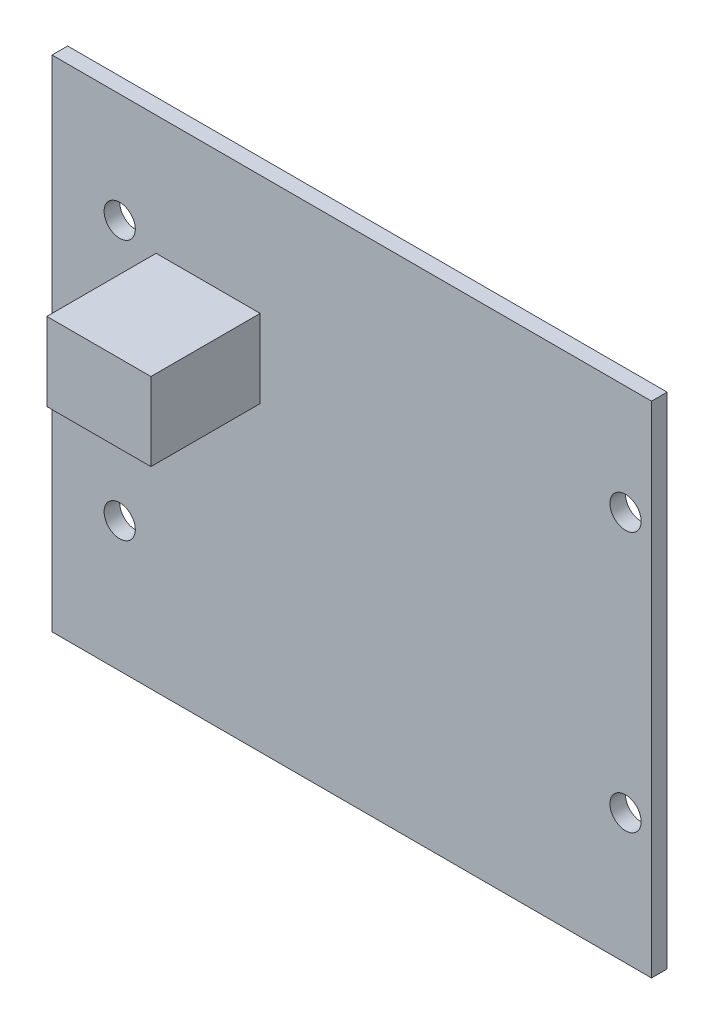
from build123d import *

# Parameters (mm, degrees)
SKICA1_W                = 57.6
SKICA1_H                = 48
SKICA1_R                = 1.5
P_IDAT_VYSUNUT_M1_DEPTH = 1.5
SKICA2_W                = 10
SKICA2_H                = 7.5
P_IDAT_VYSUNUT_M2_DEPTH = 10.5


with BuildPart() as part:
    # Skica1 → Přidat vysunutím1 (new body)
    with BuildSketch(Plane.XY):
        with Locations((28.8, 24)):
            Rectangle(SKICA1_W, SKICA1_H)
        with Locations((6.5, 37.5)):
            Circle(SKICA1_R, mode=Mode.SUBTRACT)
        with Locations((6.5, 12.5)):
            Circle(SKICA1_R, mode=Mode.SUBTRACT)
        with Locations((55.1, 37.5)):
            Circle(SKICA1_R, mode=Mode.SUBTRACT)
        with Locations((55.1, 12.5)):
            Circle(SKICA1_R, mode=Mode.SUBTRACT)
    extrude(amount=P_IDAT_VYSUNUT_M1_DEPTH)

    # Skica2 → Přidat vysunutím2 (add)
    with BuildSketch(Plane.XY.offset(1.5)):
        with Locations((15, 32.75)):
            Rectangle(SKICA2_W, SKICA2_H)
    extrude(amount=P_IDAT_VYSUNUT_M2_DEPTH)


solid = part.part
